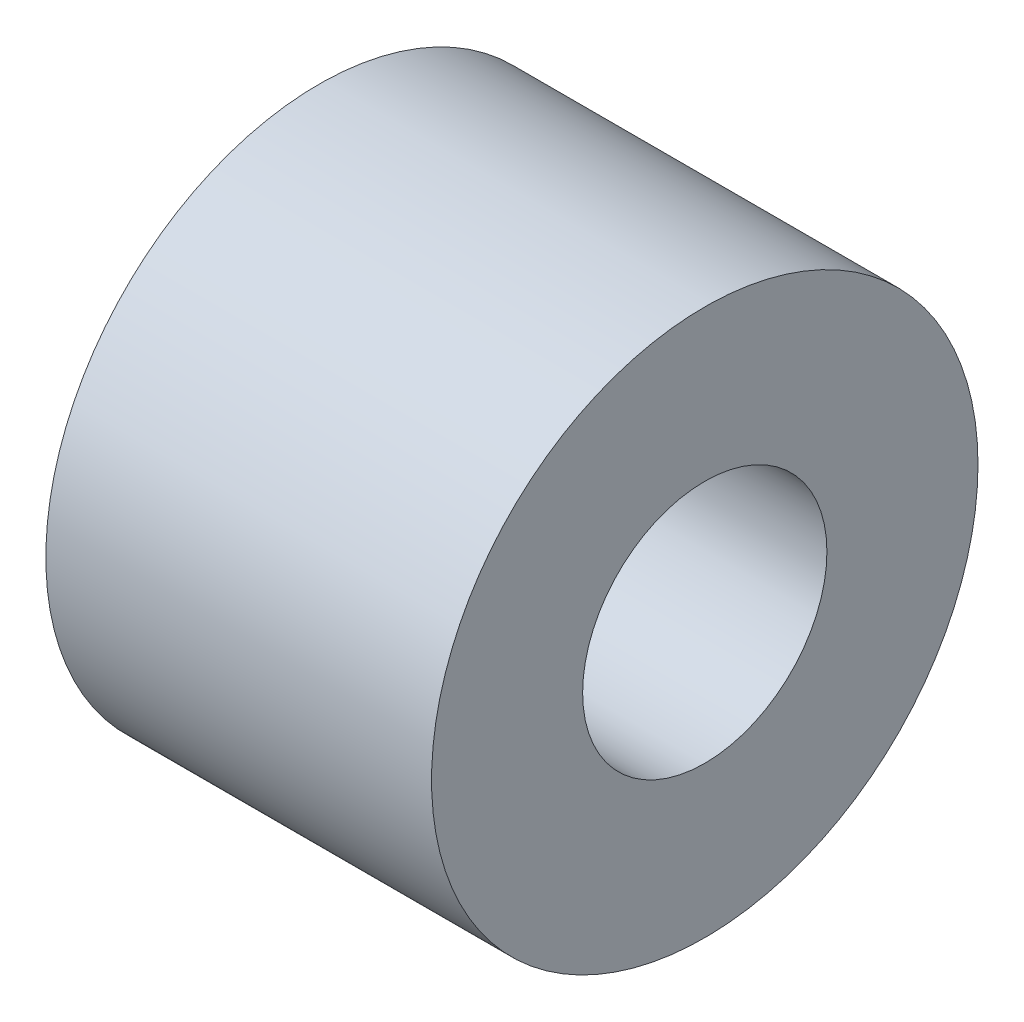
from build123d import *

# Parameters (mm, degrees)
CROQUIS1_R              = 5.3975
CROQUIS1_R_2            = 2.413
SALIENTE_EXTRUIR1_DEPTH = 7.62


with BuildPart() as part:
    # Croquis1 → Saliente-Extruir1 (new body)
    with BuildSketch(Plane(origin=(0, 0, 0), x_dir=(0, 0, -1), z_dir=(1, 0, 0))):
        Circle(CROQUIS1_R)
        Circle(CROQUIS1_R_2, mode=Mode.SUBTRACT)
    extrude(amount=-SALIENTE_EXTRUIR1_DEPTH)


solid = part.part
